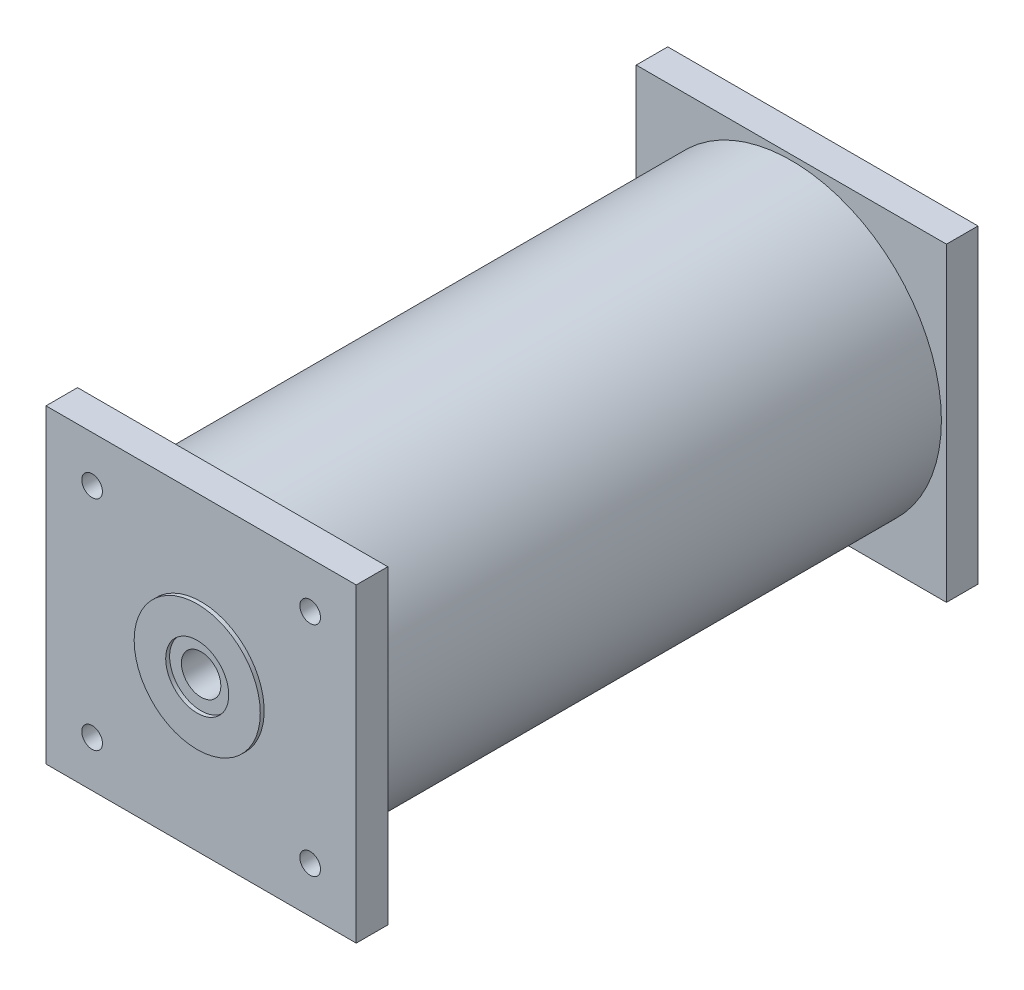
from build123d import *

# Parameters (mm, degrees)
SKETCH1_W            = 112.522
SKETCH1_H            = 30.225
SKETCH2_W            = 62.484
SKETCH2_H            = 62.484
SKETCH2_R            = 3.96875
BOSS_EXTRUDE1_DEPTH  = 6.35
SKETCH3_R            = 12.7
SKETCH3_R_2          = 6.35
BOSS_EXTRUDE2_DEPTH  = 7.1374
SKETCH4_W            = 62.484
SKETCH4_H            = 62.484
BOSS_EXTRUDE3_DEPTH  = 6.35
SKETCH5_R            = 2.0828
CUT_EXTRUDE1_DEPTH   = 8.255
LPATTERN1_COUNT      = 2
LPATTERN1_PITCH      = 118.872
SKETCH6_R            = 2.0828
CUT_EXTRUDE2_DEPTH   = 6.35
LPATTERN2_COUNT      = 2
LPATTERN2_PITCH      = 43.9166
LPATTERN2_COUNT_DIR2 = 2
LPATTERN2_PITCH_DIR2 = 43.9166


with BuildPart() as part:
    # Sketch1 → Revolve1 (revolve)
    with BuildSketch(Plane(origin=(0, 0, 0), x_dir=(0, 0, -1), z_dir=(1, 0, 0)), mode=Mode.PRIVATE) as revolve1_sk:
        with Locations((56.261, -15.1125)):
            Rectangle(SKETCH1_W, SKETCH1_H)
    revolve(revolve1_sk.sketch.rotate(Axis((0, 0, 17.588251134), (0, 0, -1)), 270), axis=Axis((0, 0, 17.588251134), (0, 0, -1)))

    # Sketch2 → Boss-Extrude1 (add)
    with BuildSketch(Plane.XY):
        Rectangle(SKETCH2_W, SKETCH2_H)
        Circle(SKETCH2_R, mode=Mode.SUBTRACT)
    extrude(amount=BOSS_EXTRUDE1_DEPTH)

    # Sketch3 → Boss-Extrude2 (add)
    with BuildSketch(Plane.XY):
        with Locations(Location((0, 0, 0), (0, 0, 180))):
            Circle(SKETCH3_R)
        with Locations(Location((0, 0, 0), (0, 0, 180))):
            Circle(SKETCH3_R_2, mode=Mode.SUBTRACT)
    extrude(amount=BOSS_EXTRUDE2_DEPTH)

    # Sketch4 → Boss-Extrude3 (add)
    with BuildSketch(Plane(origin=(0, 0, -112.522), x_dir=(-1, 0, 0), z_dir=(0, 0, -1))):
        Rectangle(SKETCH4_W, SKETCH4_H)
    extrude(amount=BOSS_EXTRUDE3_DEPTH)

    # Sketch5 → Cut-Extrude1 (cut)
    with BuildSketch(Plane.XZ.offset(31.242)):
        with Locations(Location((-15.875, 3.175, 0), (0, 0, 270))):
            Circle(SKETCH5_R)
        with Locations(Location((15.875, 3.175, 0), (0, 0, 270))):
            Circle(SKETCH5_R)
    cut_extrude1 = extrude(amount=-CUT_EXTRUDE1_DEPTH, mode=Mode.SUBTRACT)

    # LPattern1: Cut-Extrude1 ×2
    with Locations(*[(0, 0, -i * LPATTERN1_PITCH) for i in range(1, LPATTERN1_COUNT)]):
        add(cut_extrude1, mode=Mode.SUBTRACT)

    # Sketch6 → Cut-Extrude2 (cut)
    with BuildSketch(Plane.XY.offset(6.35)):
        with Locations((21.9583, -21.9583)):
            Circle(SKETCH6_R)
    cut_extrude2 = extrude(amount=-CUT_EXTRUDE2_DEPTH, mode=Mode.SUBTRACT)

    # LPattern2: Cut-Extrude2 2 × 2
    with Locations(*[(-j * LPATTERN2_PITCH_DIR2, i * LPATTERN2_PITCH, 0) for i in range(LPATTERN2_COUNT) for j in range(LPATTERN2_COUNT_DIR2) if (i, j) != (0, 0)]):
        add(cut_extrude2, mode=Mode.SUBTRACT)


solid = part.part
